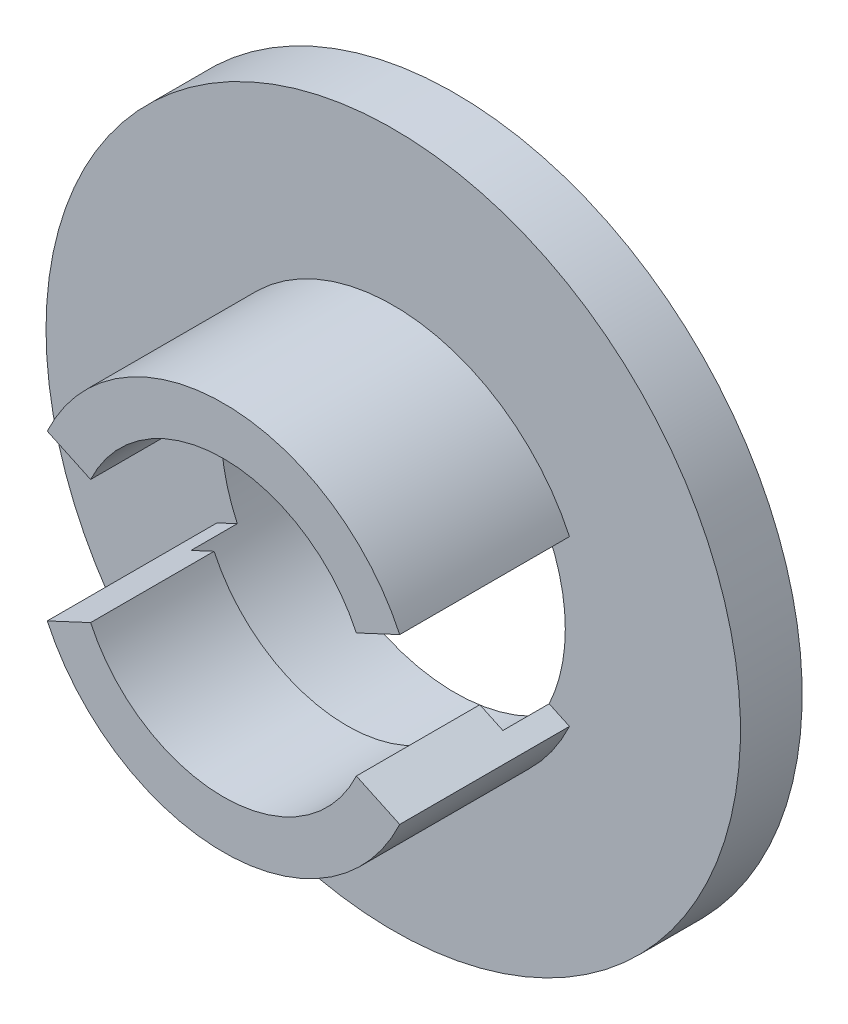
from build123d import *
from build123d.topology import SkipClean

# Parameters (mm, degrees)
ESBO_O1_R                = 11.15
RESSALTO_EXTRUS_O1_DEPTH = 15
ESBO_O2_R                = 22.5
RESSALTO_EXTRUS_O2_DEPTH = 4
RESSALTO_EXTRUS_O6_START = -8
ESBO_O5_R                = 11.15
ESBO_O5_R_2              = 8
RESSALTO_EXTRUS_O6_DEPTH = 8
RESSALTO_EXTRUS_O7_START = 4
ESBO_O7_R                = 14.2
ESBO_O7_R_2              = 11.15
RESSALTO_EXTRUS_O7_DEPTH = 4
RESSALTO_EXTRUS_O8_START = 4
ESBO_O8_R                = 11.15
ESBO_O8_R_2              = 8
RESSALTO_EXTRUS_O8_DEPTH = 4
RESSALTO_EXTRUS_O9_DEPTH = 7
CORTE_EXTRUS_O2_START    = -15
CORTE_EXTRUS_O2_DEPTH    = 15
CORTE_EXTRUS_O3_START    = -11
CORTE_EXTRUS_O3_DEPTH    = 11


with BuildPart() as part:
    # Esboço1 → Ressalto-extrusão1 (new body)
    with BuildSketch(Plane.XY):
        with BuildLine():
            Line((-2.5, 18), (-2.5, 13.978197309))
            ThreePointArc((-2.5, 13.978197309), (-10.040916293, 10.040916293), (-13.978197309, 2.5))
            Line((-13.978197309, 2.5), (-18, 2.5))
            Line((-18, 2.5), (-18, -2.5))
            Line((-18, -2.5), (-13.978197309, -2.5))
            ThreePointArc((-13.978197309, -2.5), (-10.040916293, -10.040916293), (-2.5, -13.978197309))
            Line((-2.5, -13.978197309), (-2.5, -18))
            Line((-2.5, -18), (2.5, -18))
            Line((2.5, -18), (2.5, -13.978197309))
            ThreePointArc((2.5, -13.978197309), (10.040916293, -10.040916293), (13.978197309, -2.5))
            Line((13.978197309, -2.5), (18, -2.5))
            Line((18, -2.5), (18, 2.5))
            Line((18, 2.5), (13.978197309, 2.5))
            ThreePointArc((13.978197309, 2.5), (10.040916293, 10.040916293), (2.5, 13.978197309))
            Line((2.5, 13.978197309), (2.5, 18))
            Line((2.5, 18), (-2.5, 18))
        make_face()
        Circle(ESBO_O1_R, mode=Mode.SUBTRACT)
    extrude(amount=RESSALTO_EXTRUS_O1_DEPTH)

    # Esboço5 → Ressalto-extrusão6 (add)
    with BuildSketch(Plane.XY.offset(15).offset(RESSALTO_EXTRUS_O6_START)):
        Circle(ESBO_O5_R)
        Circle(ESBO_O5_R_2, mode=Mode.SUBTRACT)
    extrude(amount=RESSALTO_EXTRUS_O6_DEPTH)



with BuildPart() as body_2:
    # Esboço2 → Ressalto-extrusão2 (new body)
    # profile 1 of 5: a face of its own
    with SkipClean():  # the faces are left unmerged after this step: merging them gives an invalid solid
        with BuildSketch(Plane(origin=(0, 0, 0), x_dir=(-1, 0, 0), z_dir=(0, 0, -1))):
            Circle(ESBO_O2_R)
            with BuildLine():
                Line((2.5, 13.978197309), (2.5, 18))
                Line((2.5, 18), (-2.5, 18))
                Line((-2.5, 18), (-2.5, 13.978197309))
                ThreePointArc((-2.5, 13.978197309), (-10.040916293, 10.040916293), (-13.978197309, 2.5))
                Line((-13.978197309, 2.5), (-18, 2.5))
                Line((-18, 2.5), (-18, -2.5))
                Line((-18, -2.5), (-13.978197309, -2.5))
                ThreePointArc((-13.978197309, -2.5), (-10.040916293, -10.040916293), (-2.5, -13.978197309))
                Line((-2.5, -13.978197309), (-2.5, -18))
                Line((-2.5, -18), (2.5, -18))
                Line((2.5, -18), (2.5, -13.978197309))
                ThreePointArc((2.5, -13.978197309), (10.040916293, -10.040916293), (13.978197309, -2.5))
                Line((13.978197309, -2.5), (18, -2.5))
                Line((18, -2.5), (18, 2.5))
                Line((18, 2.5), (13.978197309, 2.5))
                ThreePointArc((13.978197309, 2.5), (10.040916293, 10.040916293), (2.5, 13.978197309))
            make_face(mode=Mode.SUBTRACT)
        # profile 2 of 5: a face of its own
        with BuildSketch(Plane(origin=(0, 0, 0), x_dir=(-1, 0, 0), z_dir=(0, 0, -1))):
            with BuildLine():
                Line((2.5, -18), (2.5, -13.978197309))
                ThreePointArc((2.5, -13.978197309), (0, -14.2), (-2.5, -13.978197309))
                Line((-2.5, -13.978197309), (-2.5, -18))
                Line((-2.5, -18), (2.5, -18))
            make_face()
        # profile 3 of 5: a face of its own
        with BuildSketch(Plane(origin=(0, 0, 0), x_dir=(-1, 0, 0), z_dir=(0, 0, -1))):
            with BuildLine():
                ThreePointArc((-13.978197309, -2.5), (-14.2, 0), (-13.978197309, 2.5))
                Line((-13.978197309, 2.5), (-18, 2.5))
                Line((-18, 2.5), (-18, -2.5))
                Line((-18, -2.5), (-13.978197309, -2.5))
            make_face()
        # profile 4 of 5: a face of its own
        with BuildSketch(Plane(origin=(0, 0, 0), x_dir=(-1, 0, 0), z_dir=(0, 0, -1))):
            with BuildLine():
                ThreePointArc((-2.5, 13.978197309), (0, 14.2), (2.5, 13.978197309))
                Line((2.5, 13.978197309), (2.5, 18))
                Line((2.5, 18), (-2.5, 18))
                Line((-2.5, 18), (-2.5, 13.978197309))
            make_face()
        # profile 5 of 5: a face of its own
        with BuildSketch(Plane(origin=(0, 0, 0), x_dir=(-1, 0, 0), z_dir=(0, 0, -1))):
            with BuildLine():
                Line((18, 2.5), (13.978197309, 2.5))
                ThreePointArc((13.978197309, 2.5), (14.2, 0), (13.978197309, -2.5))
                Line((13.978197309, -2.5), (18, -2.5))
                Line((18, -2.5), (18, 2.5))
            make_face()
        extrude(amount=RESSALTO_EXTRUS_O2_DEPTH)


with BuildPart() as part_1:
    with SkipClean():  # the faces are left unmerged after this step: merging them gives an invalid solid
        add(part.part)

        add(body_2.part)  # Ressalto-extrusão7 merges body 2
        # Esboço7 → Ressalto-extrusão7 (add)
        with BuildSketch(Plane(origin=(0, 0, 0), x_dir=(-1, 0, 0), z_dir=(0, 0, -1)).offset(RESSALTO_EXTRUS_O7_START)):
            Circle(ESBO_O7_R)
            with Locations(Location((0, 0, 0), (0, 0, 180))):
                Circle(ESBO_O7_R_2, mode=Mode.SUBTRACT)
        extrude(amount=-RESSALTO_EXTRUS_O7_DEPTH)

    # Esboço8 → Ressalto-extrusão8 (add)
    with BuildSketch(Plane(origin=(0, 0, 7), x_dir=(-1, 0, 0), z_dir=(0, 0, -1)).offset(RESSALTO_EXTRUS_O8_START)):
        Circle(ESBO_O8_R)
        with Locations(Location((0, 0, 0), (0, 0, 180))):
            Circle(ESBO_O8_R_2, mode=Mode.SUBTRACT)
    extrude(amount=-RESSALTO_EXTRUS_O8_DEPTH)

    # Esboço9 → Ressalto-extrusão9 (add)
    with BuildSketch(Plane.XY.offset(15)):
        with BuildLine():
            Line((-11.419478117, 5.324990098), (-8.609923977, 4.014873487))
            ThreePointArc((-8.609923977, 4.014873487), (0, 9.5), (8.609923977, 4.014873487))
            Line((8.609923977, 4.014873487), (11.419478117, 5.324990098))
            ThreePointArc((11.419478117, 5.324990098), (0, 12.6), (-11.419478117, 5.324990098))
        make_face()
        with BuildLine():
            Line((-11.419478117, -5.324990098), (-8.609923977, -4.014873487))
            ThreePointArc((-8.609923977, -4.014873487), (0, -9.5), (8.609923977, -4.014873487))
            Line((8.609923977, -4.014873487), (11.419478117, -5.324990098))
            ThreePointArc((11.419478117, -5.324990098), (0, -12.6), (-11.419478117, -5.324990098))
        make_face()
    extrude(amount=RESSALTO_EXTRUS_O9_DEPTH)

    # Esboço10 → Corte-extrusão2 (cut)
    with BuildSketch(Plane.XY.offset(15).offset(CORTE_EXTRUS_O2_START)):
        with BuildLine():
            Line((-2.5, 18), (-2.5, 13.978197309))
            ThreePointArc((-2.5, 13.978197309), (-10.040916293, 10.040916293), (-13.978197309, 2.5))
            Line((-13.978197309, 2.5), (-18, 2.5))
            Line((-18, 2.5), (-18, -2.5))
            Line((-18, -2.5), (-13.978197309, -2.5))
            ThreePointArc((-13.978197309, -2.5), (-10.040916293, -10.040916293), (-2.5, -13.978197309))
            Line((-2.5, -13.978197309), (-2.5, -18))
            Line((-2.5, -18), (2.5, -18))
            Line((2.5, -18), (2.5, -13.978197309))
            ThreePointArc((2.5, -13.978197309), (10.040916293, -10.040916293), (13.978197309, -2.5))
            Line((13.978197309, -2.5), (18, -2.5))
            Line((18, -2.5), (18, 2.5))
            Line((18, 2.5), (13.978197309, 2.5))
            ThreePointArc((13.978197309, 2.5), (10.040916293, 10.040916293), (2.5, 13.978197309))
            Line((2.5, 13.978197309), (2.5, 18))
            Line((2.5, 18), (-2.5, 18))
        make_face()
        with BuildLine():
            Line((11.419478117, -5.324990098), (8.609923977, -4.014873487))
            ThreePointArc((8.609923977, -4.014873487), (0, -9.5), (-8.609923977, -4.014873487))
            Line((-8.609923977, -4.014873487), (-11.419478117, -5.324990098))
            ThreePointArc((-11.419478117, -5.324990098), (0, -12.6), (11.419478117, -5.324990098))
        make_face(mode=Mode.SUBTRACT)
        with BuildLine():
            Line((8.609923977, 4.014873487), (11.419478117, 5.324990098))
            ThreePointArc((11.419478117, 5.324990098), (0, 12.6), (-11.419478117, 5.324990098))
            Line((-11.419478117, 5.324990098), (-8.609923977, 4.014873487))
            ThreePointArc((-8.609923977, 4.014873487), (0, 9.5), (8.609923977, 4.014873487))
        make_face(mode=Mode.SUBTRACT)
    extrude(amount=CORTE_EXTRUS_O2_DEPTH, mode=Mode.SUBTRACT)

    # Esboço11 → Corte-extrusão3 (cut)
    with BuildSketch(Plane.XY.offset(22).offset(CORTE_EXTRUS_O3_START)):
        with BuildLine():
            Line((11.419478117, -5.324990098), (8.609923977, -4.014873487))
            ThreePointArc((8.609923977, -4.014873487), (0, -9.5), (-8.609923977, -4.014873487))
            Line((-8.609923977, -4.014873487), (-11.419478117, -5.324990098))
            ThreePointArc((-11.419478117, -5.324990098), (0, -12.6), (11.419478117, -5.324990098))
        make_face()
        with BuildLine():
            Line((8.609923977, 4.014873487), (11.419478117, 5.324990098))
            ThreePointArc((11.419478117, 5.324990098), (0, 12.6), (-11.419478117, 5.324990098))
            Line((-11.419478117, 5.324990098), (-8.609923977, 4.014873487))
            ThreePointArc((-8.609923977, 4.014873487), (0, 9.5), (8.609923977, 4.014873487))
        make_face()
    extrude(amount=CORTE_EXTRUS_O3_DEPTH, mode=Mode.SUBTRACT)


solid = part_1.part
